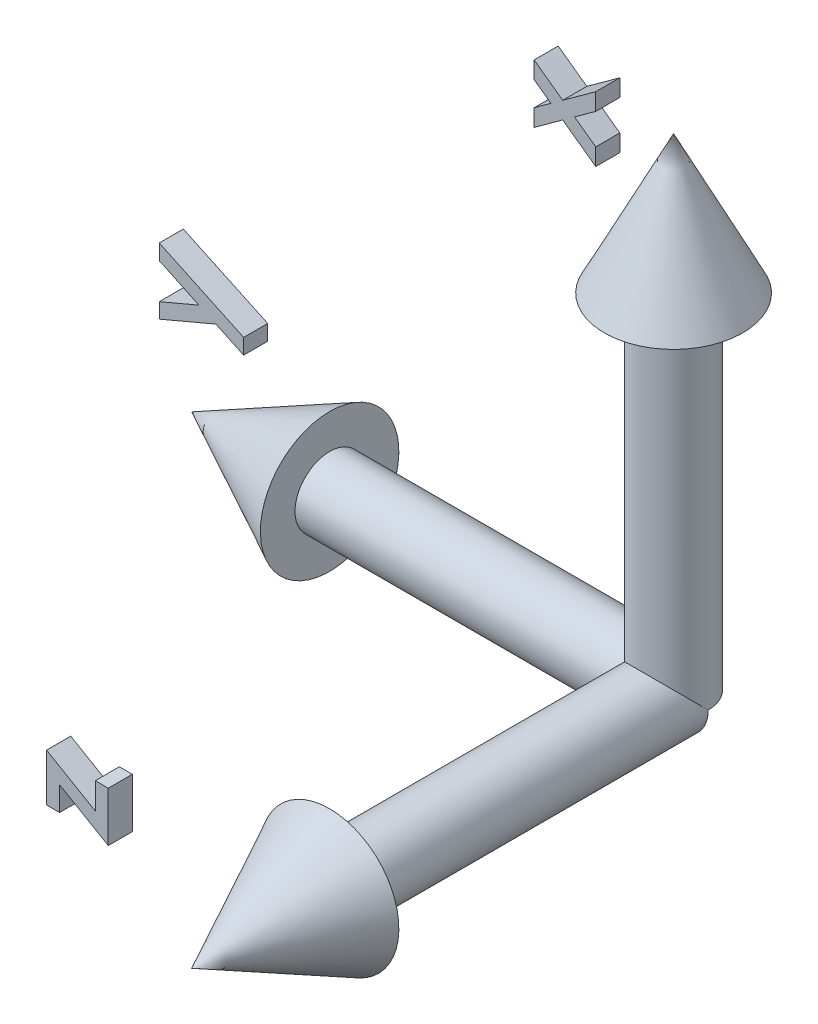
from build123d import *

# Parameters (mm, degrees)
BOSS_EXTRUDE2_DEPTH   = 0.5
BOSS_EXTRUDE2_2_DEPTH = 0.5
BOSS_EXTRUDE3_START   = 20
BOSS_EXTRUDE3_DEPTH   = 0.5


with BuildPart() as part:
    # Sketch1 → Revolve1 (revolve)
    with BuildSketch(Plane.XY, mode=Mode.PRIVATE) as revolve1_sk:
        Polygon((0, 0), (0, 20), (2.873386082, 14.274240536), (1.436693041, 14.274240536), (1.436693041, 0), align=None)
    revolve(revolve1_sk.sketch.rotate(Axis((0, 0, 0), (0, 1, 0)), 90), axis=Axis((0, 0, 0), (0, 1, 0)))

    # Sketch3 → Revolve2 (revolve)
    with BuildSketch(Plane.XY):
        Polygon((0, 0), (-20, 0), (-14.274240536, 2.873386082), (-14.274240536, 1.436693041), (0, 1.436693041), align=None)
    revolve(axis=Axis((0, 0, 0), (-1, 0, 0)))

    # Sketch5 → Revolve3 (revolve)
    with BuildSketch(Plane(origin=(0, 0, 0), x_dir=(0, 0, -1), z_dir=(1, 0, 0))):
        Polygon((0, 0), (-20, 0), (-14.274240536, 2.873386082), (-14.274240536, 1.436693041), (0, 1.436693041), align=None)
    revolve(axis=Axis((0, 0, 0), (0, 0, 1)))


with BuildPart() as body_2:
    # Sketch2 → Boss-Extrude2 (new, symmetric)
    with BuildSketch(Plane.XY):
        Polygon((-5.288177524, 17.828018559), (-5.288177524, 18.536852694), (-4.59126246, 19.042361508), (-5.288177524, 19.545766957), (-5.288177524, 20.254601091), (-4.101178325, 19.397830258), (-2.730485216, 20.392020963), (-2.730485216, 19.683186829), (-3.61109419, 19.044464873), (-2.730485216, 18.408547405), (-2.730485216, 17.699713271), (-4.101178325, 18.688996123), align=None)
    extrude(amount=BOSS_EXTRUDE2_DEPTH, both=True)


with BuildPart() as body_3:
    # Sketch2 → Boss-Extrude2 2 (new, symmetric)
    with BuildSketch(Plane.XY):
        Polygon((-20.843924957, 3.159236562), (-20.843924957, 3.788142812), (-19.198392105, 4.486460119), (-20.843924957, 5.259096337), (-20.843924957, 5.897818293), (-17.343924957, 4.253687684), (-17.343924957, 3.614965728), (-18.494465823, 4.155530632), align=None)
    extrude(amount=BOSS_EXTRUDE2_2_DEPTH, both=True)


with BuildPart() as body_4:
    # Sketch7 → Boss-Extrude3 (new, symmetric)
    with BuildSketch(Plane.XY.offset(BOSS_EXTRUDE3_START)):
        Polygon((-5.520264228, 3.358911797), (-5.520264228, 5.333270772), (-3.501033458, 4.1567884), (-3.501033458, 5.243527182), (-2.96257192, 5.243527182), (-2.96257192, 3.179424618), (-4.981802689, 4.35590699), (-4.981802689, 3.358911797), align=None)
    extrude(amount=BOSS_EXTRUDE3_DEPTH, both=True)


solid = Compound([part.part, body_2.part, body_3.part, body_4.part])
